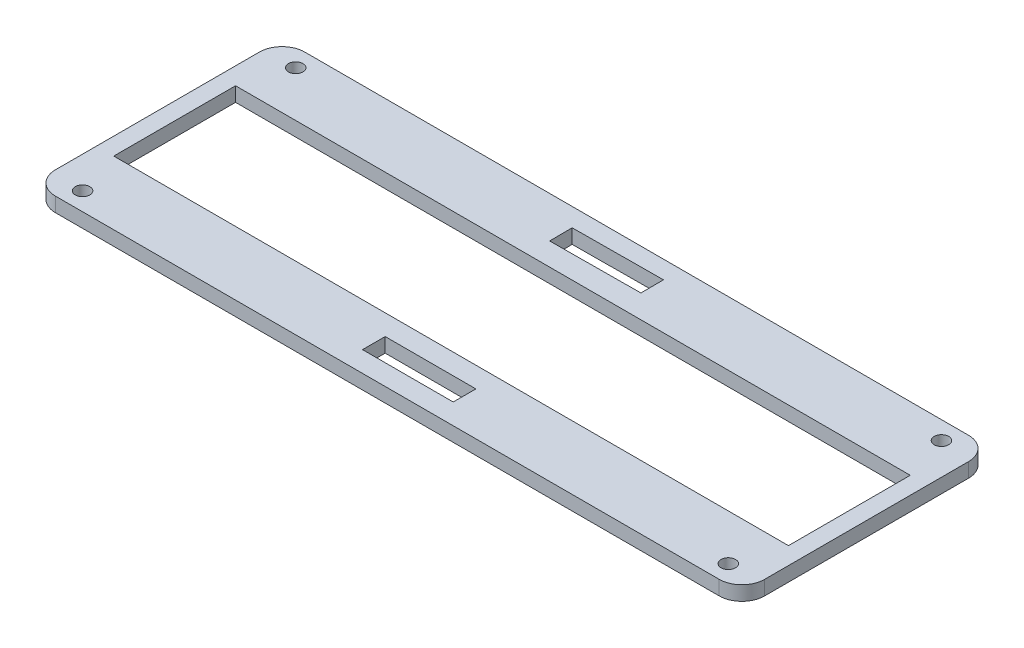
from build123d import *

# Parameters (mm, degrees)
SKETCH2_W           = 156.4
SKETCH2_H           = 55
BOSS_EXTRUDE1_DEPTH = 3.175
SKETCH3_W           = 148.78
SKETCH3_H           = 26.86
CUT_EXTRUDE1_DEPTH  = 83.955232656
SKETCH4_R           = 1.6
CUT_EXTRUDE2_DEPTH  = 83.955232656
SKETCH5_W           = 20
SKETCH5_H           = 5
CUT_EXTRUDE3_DEPTH  = 83.955232656
FILLET1_R           = 5
FILLET2_R           = 5


with BuildPart() as part:
    # Sketch2 → Boss-Extrude1 (new body)
    with BuildSketch(Plane(origin=(0, 0, 0), x_dir=(1, 0, 0), z_dir=(0, 1, 0))):
        Rectangle(SKETCH2_W, SKETCH2_H)
    extrude(amount=BOSS_EXTRUDE1_DEPTH)

    # Sketch3 → Cut-Extrude1 (cut, through all)
    with BuildSketch(Plane.XZ):
        Rectangle(SKETCH3_W, SKETCH3_H)
    extrude(amount=-CUT_EXTRUDE1_DEPTH, mode=Mode.SUBTRACT)

    # Sketch4 → Cut-Extrude2 (cut, through all)
    with BuildSketch(Plane(origin=(0, 3.175, 0), x_dir=(1, 0, 0), z_dir=(0, 1, 0))):
        with Locations(Location((-71.2, -23.5, 0), (0, 0, 270))):
            Circle(SKETCH4_R)
        with Locations(Location((-71.2, 23.5, 0), (0, 0, 90))):
            Circle(SKETCH4_R)
        with Locations(Location((71.2, 23.5, 0), (0, 0, 270))):
            Circle(SKETCH4_R)
        with Locations(Location((71.2, -23.5, 0), (0, 0, 90))):
            Circle(SKETCH4_R)
    extrude(amount=-CUT_EXTRUDE2_DEPTH, mode=Mode.SUBTRACT)

    # Sketch5 → Cut-Extrude3 (cut, through all)
    with BuildSketch(Plane(origin=(0, 3.175, 0), x_dir=(1, 0, 0), z_dir=(0, 1, 0))):
        with Locations((0, -20.465)):
            Rectangle(SKETCH5_W, SKETCH5_H)
        Polygon((-10.154798185, 23.41968691), (-10.121425865, 18.419798282), (9.878128645, 18.553287562), (9.844756325, 23.553176189), align=None)
    extrude(amount=-CUT_EXTRUDE3_DEPTH, mode=Mode.SUBTRACT)

    # Fillet1
    fillet1_edges = [part.edges().sort_by_distance(p)[0] for p in [
        (78.2, 1.5875, 27.5),
        (-78.2, 1.5875, 27.5),
        (-78.2, 1.5875, -27.5),
    ]]
    fillet(fillet1_edges, radius=FILLET1_R)

    # Fillet2
    fillet2_edges = [part.edges().sort_by_distance(p)[0] for p in [
        (78.2, 1.5875, -27.5),
    ]]
    fillet(fillet2_edges, radius=FILLET2_R)


solid = part.part
